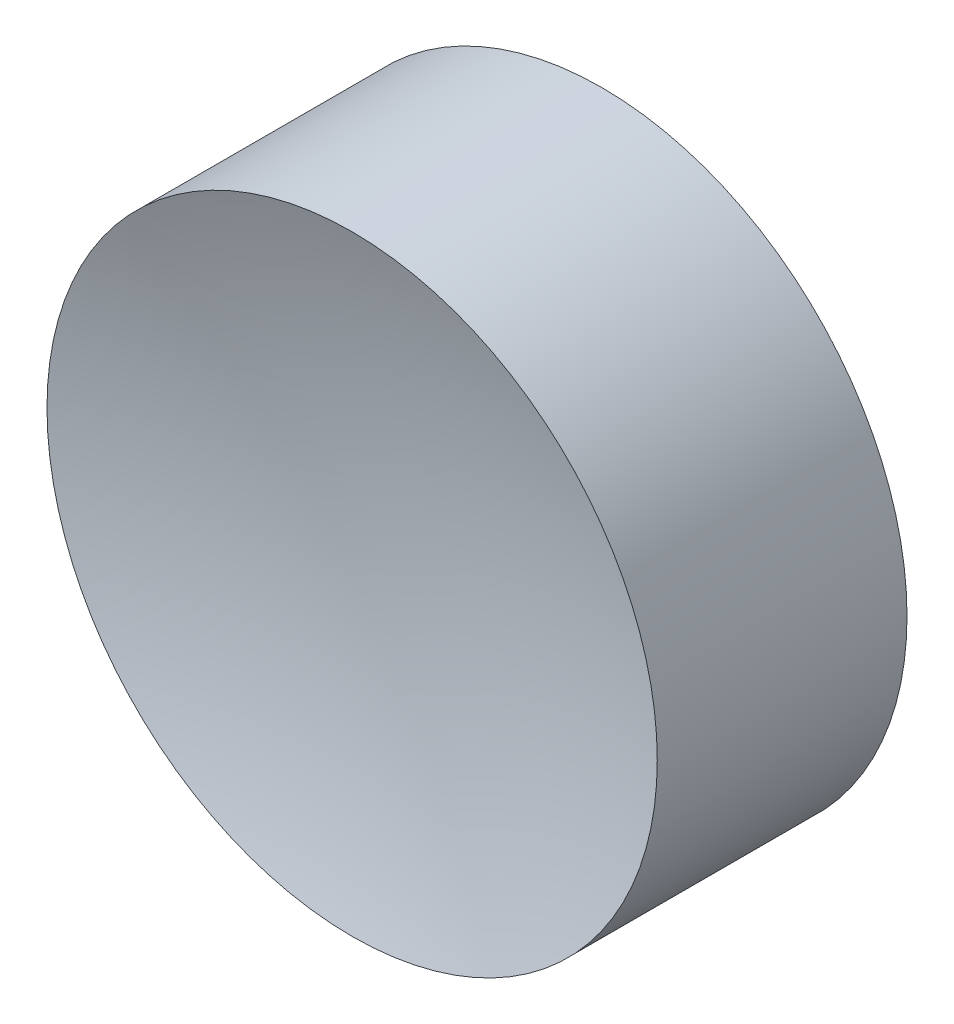
from build123d import *


with BuildPart() as part:
    # Skizze1 → Rotation1 (revolve)
    with BuildSketch(Plane(origin=(0, 0, 0), x_dir=(1, 0, 0), z_dir=(0, 1, 0))):
        with BuildLine():
            Line((0, 0.75), (0, -0.75))
            ThreePointArc((0, -0.75), (1.518893265, -0.87015916), (3, -1.22764736))
            Line((3, -1.22764736), (3, 1.22764736))
            ThreePointArc((3, 1.22764736), (1.518893265, 0.87015916), (0, 0.75))
        make_face()
    revolve(axis=Axis((0, 0, -1.22764736), (0, 0, 1)))


solid = part.part
